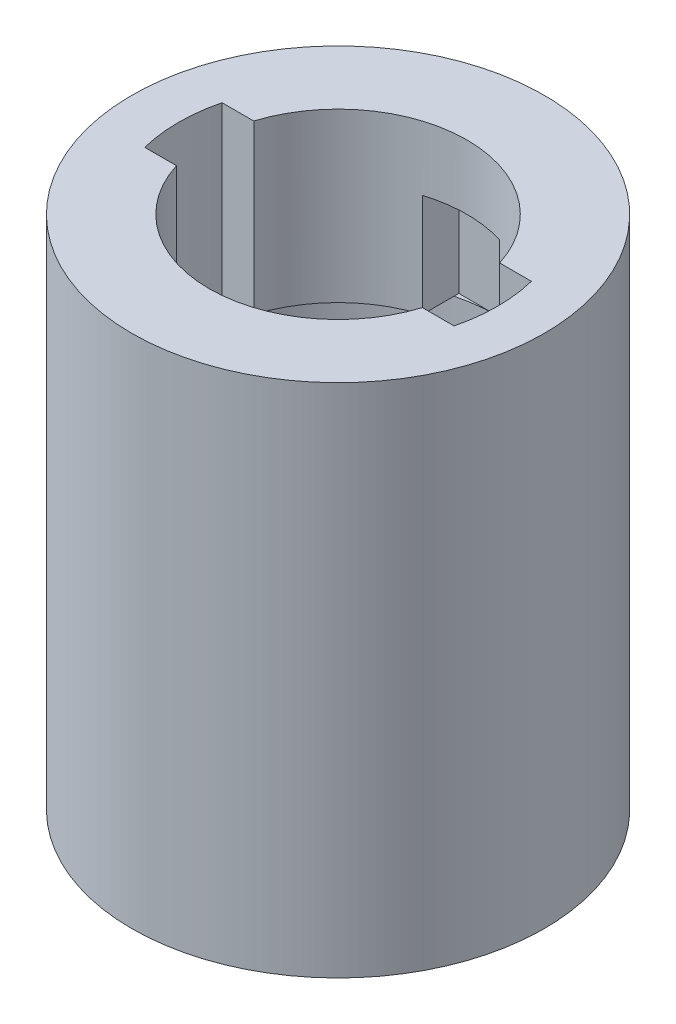
from build123d import *

# Parameters (mm, degrees)
SKETCH_1_R          = 8
SKETCH_1_R_2        = 5
EXTRUDE_1_DEPTH     = 20
CUT_EXTRUDE_2_DEPTH = 9.5
CUT_EXTRUDE_3_DEPTH = 4


with BuildPart() as part:
    # Эскиз1 → Вытянуть1 (new body)
    with BuildSketch(Plane(origin=(0, 0, 0), x_dir=(1, 0, 0), z_dir=(0, 1, 0))):
        with Locations(Location((0, 0, 0), (0, 0, 270))):
            Circle(SKETCH_1_R)
        with Locations(Location((0, 0, 0), (0, 0, 270))):
            Circle(SKETCH_1_R_2, mode=Mode.SUBTRACT)
    extrude(amount=EXTRUDE_1_DEPTH)

    # Эскиз2 → Вытянуть2 (cut)
    with BuildSketch(Plane(origin=(0, 20, 0), x_dir=(1, 0, 0), z_dir=(0, 1, 0))):
        with BuildLine():
            Line((-6, 1.5), (6, 1.5))
            ThreePointArc((6, 1.5), (6.184658438, 0), (6, -1.5))
            Line((6, -1.5), (-6, -1.5))
            ThreePointArc((-6, -1.5), (-6.184658438, 0), (-6, 1.5))
        make_face()
    extrude(amount=-CUT_EXTRUDE_2_DEPTH, mode=Mode.SUBTRACT)

    # Эскиз4 → Вырез-Повернуть2 (revolve, cut)
    with BuildSketch(Plane.XY, mode=Mode.PRIVATE) as cut_revolve_2_sk:
        Polygon((0, 10.5), (6, 10.5), (6.184658438, 10.5), (6.184658438, 13.5), (6, 13.5), (0, 13.5), align=None)
    revolve(cut_revolve_2_sk.sketch.rotate(Axis((0, 0, 0), (0, 1, 0)), 270), axis=Axis((0, 0, 0), (0, 1, 0)), mode=Mode.SUBTRACT)

    # Эскиз5 → Вытянуть3 (cut)
    with BuildSketch(Plane.XZ.offset(-13.5)):
        Polygon((-1.5, 6.184658438), (1.5, 6.184658438), (1.5, 6), (1.5, -6), (1.5, -6.184658438), (-1.5, -6.184658438), (-1.5, -6), (-1.5, 6), align=None)
    extrude(amount=-CUT_EXTRUDE_3_DEPTH, mode=Mode.SUBTRACT)


solid = part.part
